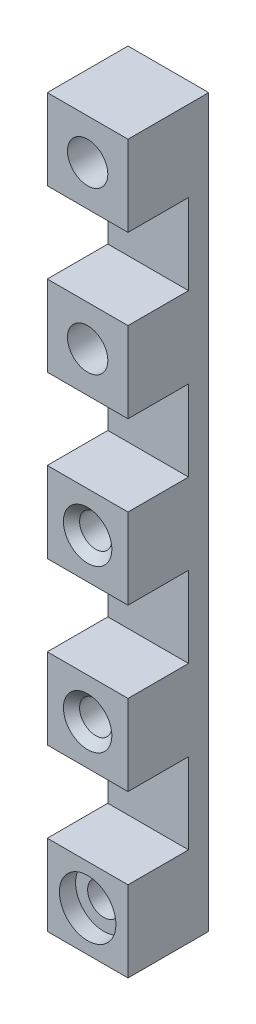
from build123d import *

# Parameters (mm, degrees)
SKETCH_1_W               = 20
SKETCH_1_H               = 20
EXTRUDE_1_DEPTH          = 15
SKETCH_1_5_W             = 20
SKETCH_1_5_H             = 40
EXTRUDE_2_DEPTH          = 5
PATTERN_LINEAR_1_COUNT   = 5
PATTERN_LINEAR_1_PITCH   = 40
CUT_EXTRUDE_1_DEPTH      = 181.900525151
CUT_EXTRUDE_1_DEPTH_BACK = 181.900525151
SKETCH_2_W               = 20
SKETCH_2_H               = 20
SKETCH_3_R               = 5
CUT_EXTRUDE_2_DEPTH      = 162.554944214
SKETCH_4_R               = 5
CUT_EXTRUDE_3_DEPTH      = 15
SKETCH_5_R               = 4
CUT_EXTRUDE_4_DEPTH      = 162.554944214
CHAMFER_1_SIZE           = 2
CHAMFER_2_SIZE           = 2
SKETCH_6_R               = 7
CUT_EXTRUDE_5_DEPTH      = 4


with BuildPart() as part:
    # Эскиз1 → Бобышка-Вытянуть1 (new body)
    with BuildSketch(Plane.XY):
        with Locations((0, 10)):
            Rectangle(SKETCH_1_W, SKETCH_1_H)
    extrude(amount=EXTRUDE_1_DEPTH)

    # Эскиз1<5> → Бобышка-Вытянуть2 (add)
    with BuildSketch(Plane.XY):
        Rectangle(SKETCH_1_5_W, SKETCH_1_5_H)
    extrude(amount=-EXTRUDE_2_DEPTH)


with BuildPart() as pattern_linear_1_1:
    # Линейный массив1: pattern copy
    add(part.part.moved(Location(Vector(0, -1, 0) * (1 * PATTERN_LINEAR_1_PITCH))))

    # Эскиз4 → Вырез-Вытянуть3 (cut)
    with BuildSketch(Plane.XY.offset(15)):
        with Locations((0, -30)):
            Circle(SKETCH_4_R)
    extrude(amount=-CUT_EXTRUDE_3_DEPTH, mode=Mode.SUBTRACT)


with BuildPart() as pattern_linear_1_2:
    # Линейный массив1: pattern copy
    add(part.part.moved(Location(Vector(0, -1, 0) * (2 * PATTERN_LINEAR_1_PITCH))))


with BuildPart() as pattern_linear_1_3:
    # Линейный массив1: pattern copy
    add(part.part.moved(Location(Vector(0, -1, 0) * (3 * PATTERN_LINEAR_1_PITCH))))


with BuildPart() as pattern_linear_1_4:
    # Линейный массив1: pattern copy
    add(part.part.moved(Location(Vector(0, -1, 0) * (4 * PATTERN_LINEAR_1_PITCH))))

    # Эскиз2 → Вырез-Вытянуть1 (cut, two sides: drawn at the far end of the back side and taken through both)
    with BuildSketch(Plane.XY.offset(-CUT_EXTRUDE_1_DEPTH_BACK)):
        with Locations((0, -170)):
            Rectangle(SKETCH_2_W, SKETCH_2_H)
    extrude(amount=CUT_EXTRUDE_1_DEPTH + CUT_EXTRUDE_1_DEPTH_BACK, mode=Mode.SUBTRACT)


with BuildPart() as part_1:
    add(part.part)

    # Эскиз3 → Вырез-Вытянуть2 (cut, through all)
    with BuildSketch(Plane.XY.offset(15)):
        with Locations((0, 10)):
            Circle(SKETCH_3_R)
    extrude(amount=-CUT_EXTRUDE_2_DEPTH, mode=Mode.SUBTRACT)


with BuildPart() as cut_extrude_4_tool:
    # Эскиз5 → Вырез-Вытянуть4 (new, through all)
    with BuildSketch(Plane.XY.offset(15)):
        with Locations((0, -70)):
            Circle(SKETCH_5_R)
        with Locations((0, -110)):
            Circle(SKETCH_5_R)
        with Locations((0, -150)):
            Circle(SKETCH_5_R)
    extrude(amount=-CUT_EXTRUDE_4_DEPTH)


with BuildPart() as pattern_linear_1_2_1:
    add(pattern_linear_1_2.part)

    # Вырез-Вытянуть4: cut by cut_extrude_4_tool
    add(cut_extrude_4_tool.part, mode=Mode.SUBTRACT)

    # Фаска1
    chamfer_1_edges = [pattern_linear_1_2_1.edges().sort_by_distance(p)[0] for p in [
        (-4, -70, 15),
    ]]
    chamfer(chamfer_1_edges, length=CHAMFER_1_SIZE)


with BuildPart() as pattern_linear_1_3_1:
    add(pattern_linear_1_3.part)

    # Вырез-Вытянуть4: cut by cut_extrude_4_tool
    add(cut_extrude_4_tool.part, mode=Mode.SUBTRACT)

    # Фаска2
    chamfer_2_edges = [pattern_linear_1_3_1.edges().sort_by_distance(p)[0] for p in [
        (-4, -110, 15),
    ]]
    chamfer(chamfer_2_edges, length=CHAMFER_2_SIZE)


with BuildPart() as pattern_linear_1_4_1:
    add(pattern_linear_1_4.part)

    # Вырез-Вытянуть4: cut by cut_extrude_4_tool
    add(cut_extrude_4_tool.part, mode=Mode.SUBTRACT)

    # Эскиз6 → Вырез-Вытянуть5 (cut)
    with BuildSketch(Plane.XY.offset(15)):
        with Locations((0, -150)):
            Circle(SKETCH_6_R)
    extrude(amount=-CUT_EXTRUDE_5_DEPTH, mode=Mode.SUBTRACT)


with BuildPart() as part_2:
    add(part_1.part)

    # Combine 1: union Линейный массив1_1, Линейный массив1_2, Линейный массив1_3, Линейный массив1_4
    add(pattern_linear_1_1.part)
    add(pattern_linear_1_2_1.part)
    add(pattern_linear_1_3_1.part)
    add(pattern_linear_1_4_1.part)


solid = part_2.part
